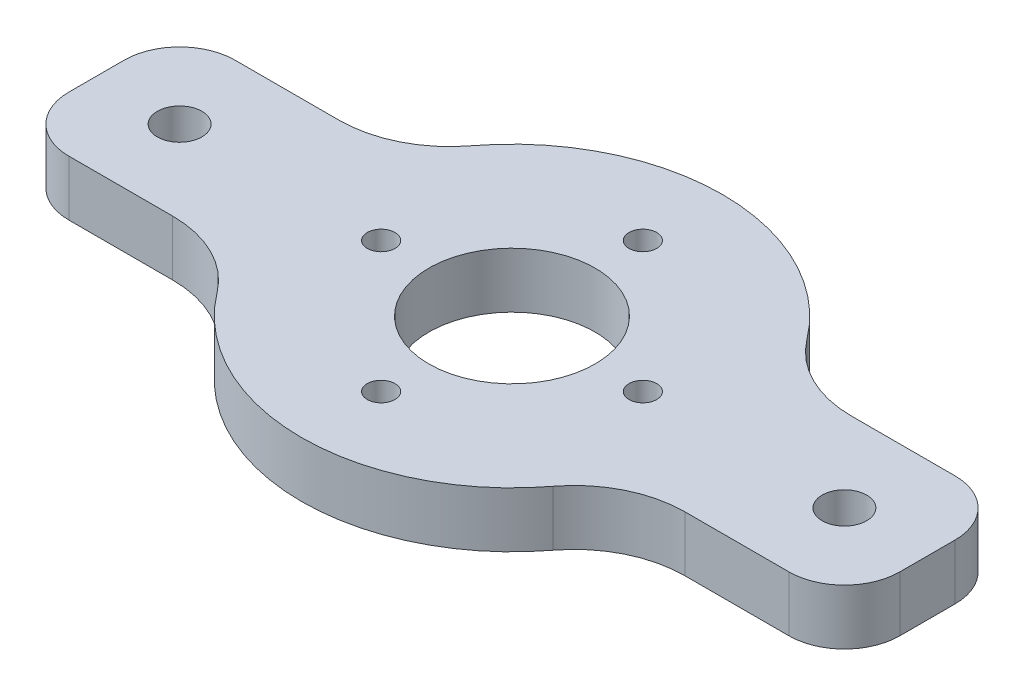
from build123d import *

# Parameters (mm, degrees)
SKETCH1_R           = 1.5875
SKETCH1_R_2         = 2.5527
BOSS_EXTRUDE2_DEPTH = 6.35


with BuildPart() as part:
    # Sketch1 → Boss-Extrude2 (new body)
    # profile 1 of 10: a face of its own
    with BuildSketch(Plane(origin=(0, 0, 0), x_dir=(1, 0, 0), z_dir=(0, 1, 0))):
        with BuildLine():
            Line((-4.5e-08, 9.525), (-22.170504618, 9.525))
            ThreePointArc((-22.170504618, 9.525), (-24.13, 0), (-22.170504618, -9.525))
            Line((-22.170504618, -9.525), (4.2e-08, -9.525))
            ThreePointArc((4.2e-08, -9.525), (-9.525, -4.4e-08), (-4.5e-08, 9.525))
        make_face()
        with Locations(Location((-15, 0, 0), (0, 0, 270))):
            Circle(SKETCH1_R, mode=Mode.SUBTRACT)
    # profile 2 of 10: a face of its own
    with BuildSketch(Plane(origin=(0, 0, 0), x_dir=(1, 0, 0), z_dir=(0, 1, 0))):
        with BuildLine():
            Line((22.170504618, 9.525), (-4.5e-08, 9.525))
            ThreePointArc((-4.5e-08, 9.525), (6.735192075, 6.735192107), (9.525, 0))
            ThreePointArc((9.525, 0), (6.735192106, -6.735192076), (4.2e-08, -9.525))
            Line((4.2e-08, -9.525), (22.170504618, -9.525))
            ThreePointArc((22.170504618, -9.525), (23.635049994, -4.86223321), (24.13, 0))
            ThreePointArc((24.13, 0), (23.635049994, 4.86223321), (22.170504618, 9.525))
        make_face()
        with Locations(Location((15, 0, 0), (0, 0, 270))):
            Circle(SKETCH1_R, mode=Mode.SUBTRACT)
    # profile 3 of 10: a face of its own
    with BuildSketch(Plane(origin=(0, 0, 0), x_dir=(1, 0, 0), z_dir=(0, 1, 0))):
        with BuildLine():
            Line((4.2e-08, -9.525), (-22.170504618, -9.525))
            ThreePointArc((-22.170504618, -9.525), (-20.858463978, -12.131833353), (-19.241313721, -14.561206897))
            ThreePointArc((-19.241313721, -14.561206897), (0, -24.13), (19.241313721, -14.561206897))
            ThreePointArc((19.241313721, -14.561206897), (20.858463978, -12.131833353), (22.170504618, -9.525))
            Line((22.170504618, -9.525), (4.2e-08, -9.525))
        make_face()
        with Locations(Location((0, -15, 0), (0, 0, 270))):
            Circle(SKETCH1_R, mode=Mode.SUBTRACT)
    # profile 4 of 10: a face of its own
    with BuildSketch(Plane(origin=(0, 0, 0), x_dir=(1, 0, 0), z_dir=(0, 1, 0))):
        with BuildLine():
            ThreePointArc((-19.241313721, 14.561206897), (-20.858463978, 12.131833353), (-22.170504618, 9.525))
            Line((-22.170504618, 9.525), (-4.5e-08, 9.525))
            Line((-4.5e-08, 9.525), (22.170504618, 9.525))
            ThreePointArc((22.170504618, 9.525), (20.858463978, 12.131833353), (19.241313721, 14.561206897))
            ThreePointArc((19.241313721, 14.561206897), (0, 24.13), (-19.241313721, 14.561206897))
        make_face()
        with Locations(Location((0, 15, 0), (0, 0, 270))):
            Circle(SKETCH1_R, mode=Mode.SUBTRACT)
    # profile 5 of 10: a face of its own
    with BuildSketch(Plane(origin=(0, 0, 0), x_dir=(1, 0, 0), z_dir=(0, 1, 0))):
        with BuildLine():
            Line((-29.368320943, 9.525), (-41.275, 9.525))
            ThreePointArc((-41.275, 9.525), (-45.765128061, 7.665128061), (-47.625, 3.175))
            Line((-47.625, 3.175), (-47.625, -3.175))
            ThreePointArc((-47.625, -3.175), (-45.765128061, -7.665128061), (-41.275, -9.525))
            Line((-41.275, -9.525), (-29.368320943, -9.525))
            Line((-29.368320943, -9.525), (-22.170504618, -9.525))
            ThreePointArc((-22.170504618, -9.525), (-24.13, 0), (-22.170504618, 9.525))
            Line((-22.170504618, 9.525), (-29.368320943, 9.525))
        make_face()
        with Locations(Location((-38.1, 0, 0), (0, 0, 270))):
            Circle(SKETCH1_R_2, mode=Mode.SUBTRACT)
    # profile 6 of 10: a face of its own
    with BuildSketch(Plane(origin=(0, 0, 0), x_dir=(1, 0, 0), z_dir=(0, 1, 0))):
        with BuildLine():
            Line((29.368320943, 9.525), (22.170504618, 9.525))
            ThreePointArc((22.170504618, 9.525), (23.635049994, 4.86223321), (24.13, 0))
            ThreePointArc((24.13, 0), (23.635049994, -4.86223321), (22.170504618, -9.525))
            Line((22.170504618, -9.525), (29.368320943, -9.525))
            Line((29.368320943, -9.525), (41.275, -9.525))
            ThreePointArc((41.275, -9.525), (45.765128061, -7.665128061), (47.625, -3.175))
            Line((47.625, -3.175), (47.625, 3.175))
            ThreePointArc((47.625, 3.175), (45.765128061, 7.665128061), (41.275, 9.525))
            Line((41.275, 9.525), (29.368320943, 9.525))
        make_face()
        with Locations(Location((38.1, 0, 0), (0, 0, 270))):
            Circle(SKETCH1_R_2, mode=Mode.SUBTRACT)
    # profile 7 of 10: a face of its own
    with BuildSketch(Plane(origin=(0, 0, 0), x_dir=(1, 0, 0), z_dir=(0, 1, 0))):
        with BuildLine():
            ThreePointArc((-19.241313721, 14.561206897), (-23.713242359, 10.853540718), (-29.368320943, 9.525))
            Line((-29.368320943, 9.525), (-22.170504618, 9.525))
            ThreePointArc((-22.170504618, 9.525), (-20.858463978, 12.131833353), (-19.241313721, 14.561206897))
        make_face()
    # profile 8 of 10: a face of its own
    with BuildSketch(Plane(origin=(0, 0, 0), x_dir=(1, 0, 0), z_dir=(0, 1, 0))):
        with BuildLine():
            ThreePointArc((-19.241313721, -14.561206897), (-20.858463978, -12.131833353), (-22.170504618, -9.525))
            Line((-22.170504618, -9.525), (-29.368320943, -9.525))
            ThreePointArc((-29.368320943, -9.525), (-23.713242359, -10.853540718), (-19.241313721, -14.561206897))
        make_face()
    # profile 9 of 10: a face of its own
    with BuildSketch(Plane(origin=(0, 0, 0), x_dir=(1, 0, 0), z_dir=(0, 1, 0))):
        with BuildLine():
            ThreePointArc((29.368320943, 9.525), (23.713242359, 10.853540718), (19.241313721, 14.561206897))
            ThreePointArc((19.241313721, 14.561206897), (20.858463978, 12.131833353), (22.170504618, 9.525))
            Line((22.170504618, 9.525), (29.368320943, 9.525))
        make_face()
    # profile 10 of 10: a face of its own
    with BuildSketch(Plane(origin=(0, 0, 0), x_dir=(1, 0, 0), z_dir=(0, 1, 0))):
        with BuildLine():
            Line((29.368320943, -9.525), (22.170504618, -9.525))
            ThreePointArc((22.170504618, -9.525), (20.858463978, -12.131833353), (19.241313721, -14.561206897))
            ThreePointArc((19.241313721, -14.561206897), (23.713242359, -10.853540718), (29.368320943, -9.525))
        make_face()
    extrude(amount=BOSS_EXTRUDE2_DEPTH)


solid = part.part
